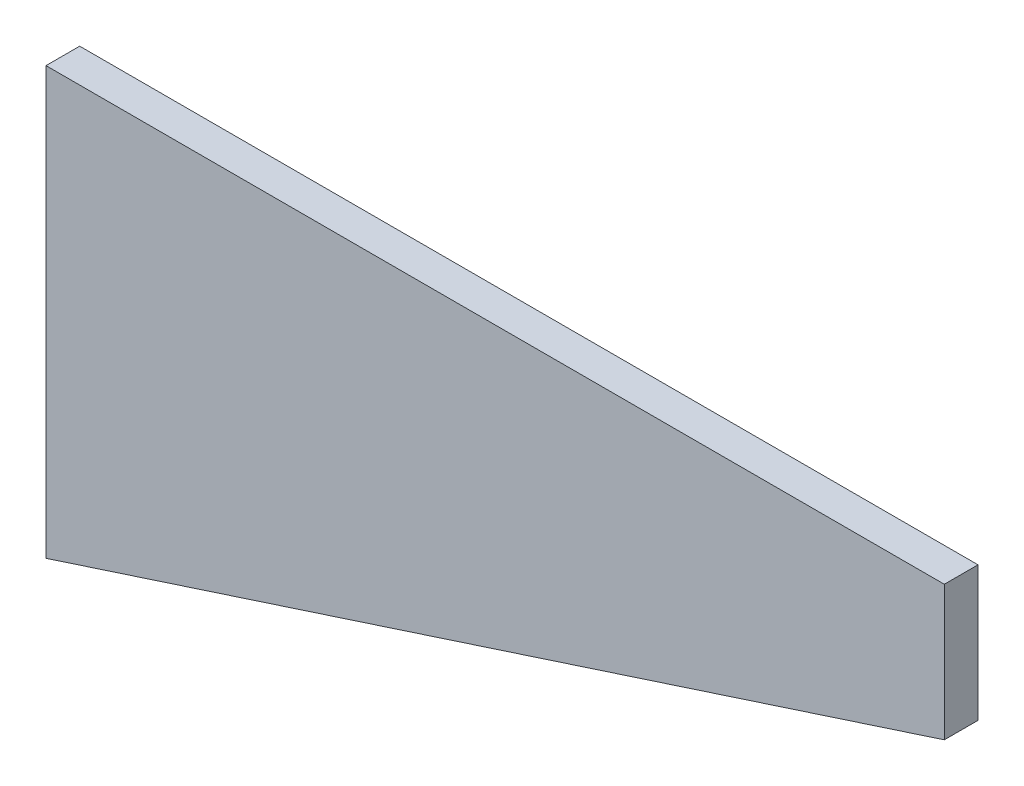
from build123d import *

# Parameters (mm, degrees)
BOSS_EXTRU_1_DEPTH = 15


with BuildPart() as part:
    # Esquisse1 → Boss.-Extru.1 (new body)
    with BuildSketch(Plane.XY):
        Polygon((0, -469.409867617), (400, -469.409867617), (400, -529.409867617), (0, -659.409867617), align=None)
    extrude(amount=-BOSS_EXTRU_1_DEPTH)


solid = part.part
